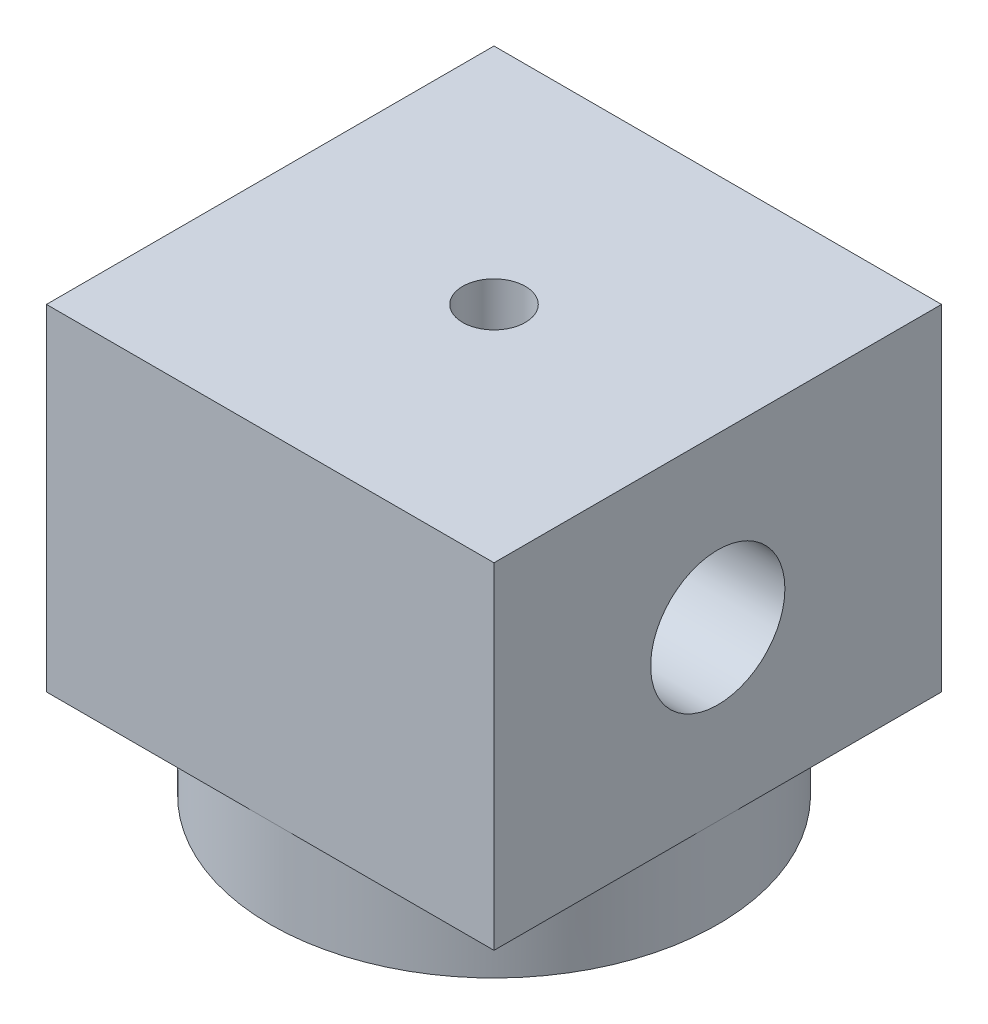
from build123d import *

# Parameters (mm, degrees)
SKETCH1_R           = 10
BOSS_EXTRUDE1_DEPTH = 4
SKETCH2_R           = 2.45
CUT_EXTRUDE1_DEPTH  = 2.5
SKETCH3_W           = 20
SKETCH3_H           = 15
SKETCH3_R           = 3
BOSS_EXTRUDE2_DEPTH = 10
SKETCH4_R           = 1.4
CUT_EXTRUDE2_DEPTH  = 8


with BuildPart() as part:
    # Sketch1 → Boss-Extrude1 (new body)
    with BuildSketch(Plane(origin=(0, 0, 0), x_dir=(1, 0, 0), z_dir=(0, 1, 0))):
        with Locations(Location((0, 0, 0), (0, 0, 270))):
            Circle(SKETCH1_R)
    extrude(amount=BOSS_EXTRUDE1_DEPTH)

    # Sketch2 → Cut-Extrude1 (cut)
    with BuildSketch(Plane.XZ):
        with Locations(Location((0, 0, 0), (0, 0, 270))):
            Circle(SKETCH2_R)
    extrude(amount=-CUT_EXTRUDE1_DEPTH, mode=Mode.SUBTRACT)

    # Sketch3 → Boss-Extrude2 (add, symmetric)
    with BuildSketch(Plane(origin=(0, 0, 0), x_dir=(0, 0, -1), z_dir=(1, 0, 0))):
        with Locations((0, 11.5)):
            Rectangle(SKETCH3_W, SKETCH3_H)
        with Locations((0, 11.5)):
            Circle(SKETCH3_R, mode=Mode.SUBTRACT)
    extrude(amount=BOSS_EXTRUDE2_DEPTH, both=True)

    # Sketch4 → Cut-Extrude2 (cut)
    with BuildSketch(Plane(origin=(0, 19, 0), x_dir=(1, 0, 0), z_dir=(0, 1, 0))):
        with Locations(Location((0, 0, 0), (0, 0, 270))):
            Circle(SKETCH4_R)
    extrude(amount=-CUT_EXTRUDE2_DEPTH, mode=Mode.SUBTRACT)


solid = part.part
